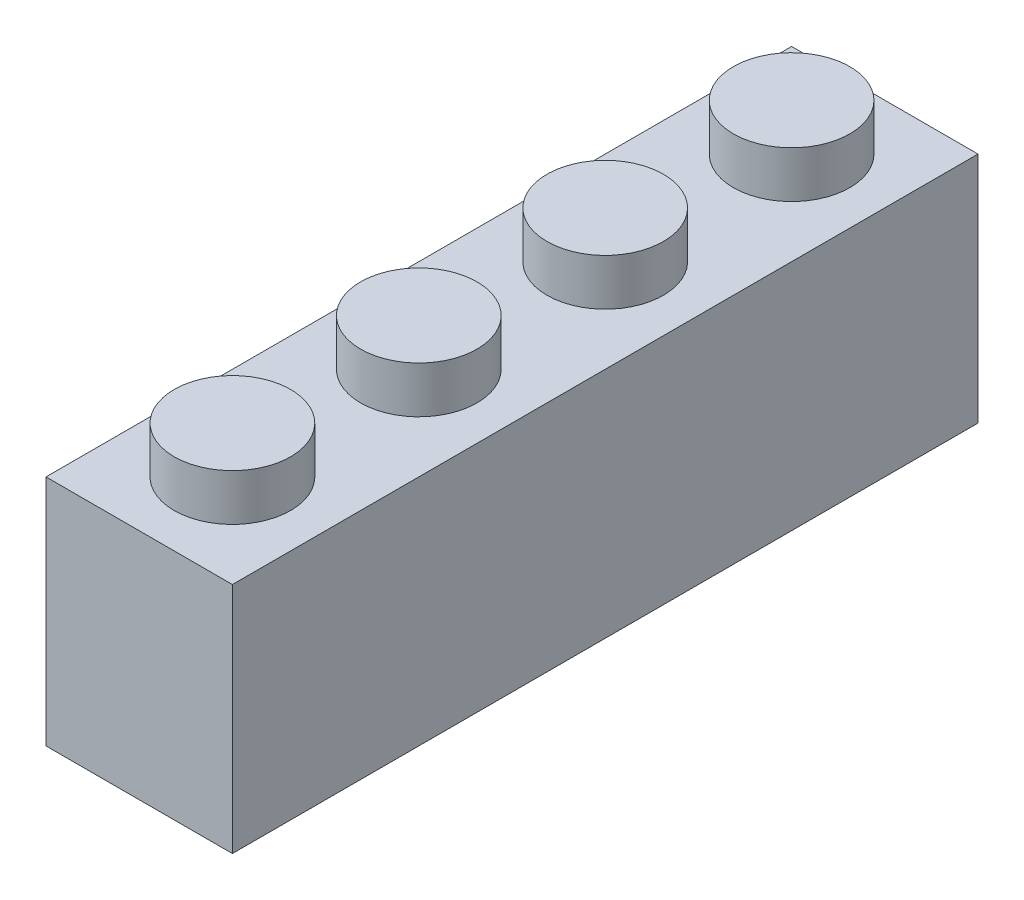
from build123d import *

# Parameters (mm, degrees)
SKETCH1_W                 = 8
SKETCH1_H                 = 32
BASE_EXTRUDE_DEPTH        = 5
SKETCH2_R                 = 2.5
BOSS_EXTRUDE1_DEPTH       = 2
TOP_BUTTON_PATTERN_COUNT  = 4
TOP_BUTTON_PATTERN_PITCH  = 8
SHELL1_T                  = -1
SKETCH3_R                 = 1
BOTTOM_POST_DEPTH         = 8
BOTTOM_POST_PATTERN_COUNT = 3
BOTTOM_POST_PATTERN_PITCH = 8


with BuildPart() as part:
    # Sketch1 → Base-Extrude (new, symmetric)
    with BuildSketch(Plane(origin=(0, 0, 0), x_dir=(1, 0, 0), z_dir=(0, 1, 0))):
        Rectangle(SKETCH1_W, SKETCH1_H)
    extrude(amount=BASE_EXTRUDE_DEPTH, both=True)

    # Sketch2 → Boss-Extrude1 (add)
    with BuildSketch(Plane(origin=(0, 5, 0), x_dir=(-1, 0, 0), z_dir=(0, 1, 0))):
        with Locations(Location((0, 12, 0), (0, 0, 90))):
            Circle(SKETCH2_R)
    boss_extrude1 = extrude(amount=BOSS_EXTRUDE1_DEPTH)

    # Top Button Pattern: Boss-Extrude1 ×4
    with Locations(*[(0, 0, -i * TOP_BUTTON_PATTERN_PITCH) for i in range(1, TOP_BUTTON_PATTERN_COUNT)]):
        add(boss_extrude1)

    # Shell1
    shell1_openings = [part.faces().sort_by_distance(p)[0] for p in [
        (0, -5, 0),
    ]]
    offset(amount=SHELL1_T, openings=shell1_openings, kind=Kind.INTERSECTION)

    # Sketch3 → Bottom Post (add)
    with BuildSketch(Plane.XZ.offset(-4)):
        with Locations(Location((0, 8, 0), (0, 0, 90))):
            Circle(SKETCH3_R)
    bottom_post = extrude(amount=BOTTOM_POST_DEPTH)

    # Bottom Post Pattern: Bottom Post ×3
    with Locations(*[(0, 0, -i * BOTTOM_POST_PATTERN_PITCH) for i in range(1, BOTTOM_POST_PATTERN_COUNT)]):
        add(bottom_post)


solid = part.part
